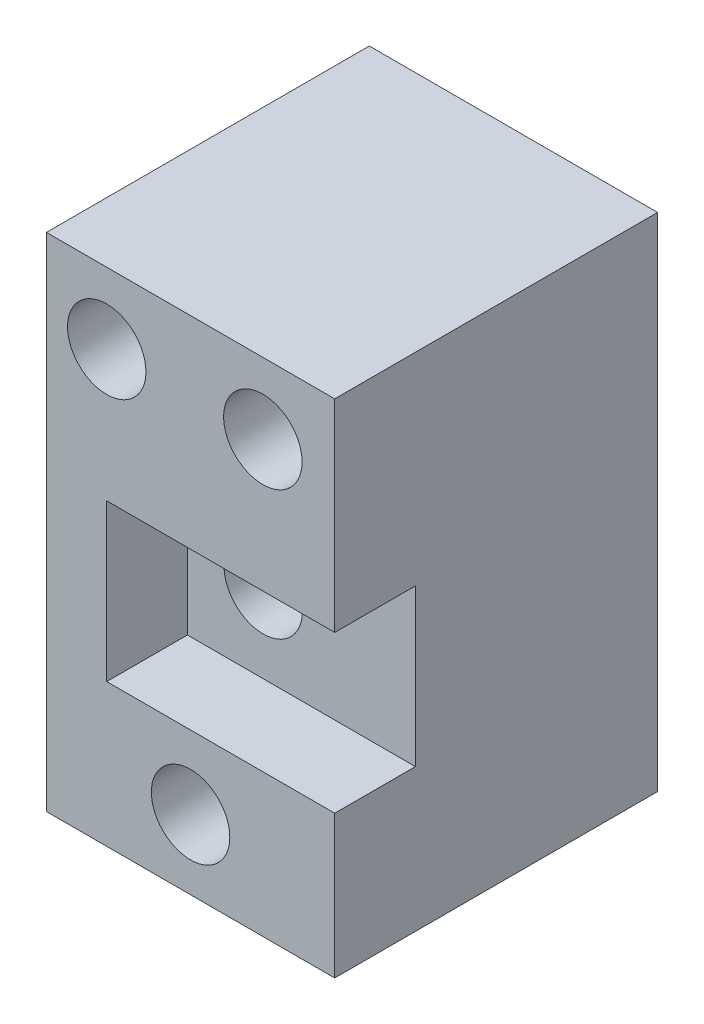
from build123d import *

# Parameters (mm, degrees)
ESQUISSE1_W             = 12.5
ESQUISSE1_H             = 21.75
BOSS_EXTRU_3_DEPTH      = 14
ESQUISSE9_W             = 10.579409941
ESQUISSE9_H             = 6.787962443
ENL_V_MAT_EXTRU_7_DEPTH = 3.5
D_GAGEMENT_M32_D        = 3.4
D_GAGEMENT_M33_D        = 3.4


with BuildPart() as part:
    # Esquisse1 → Boss.-Extru.3 (new body)
    with BuildSketch(Plane.XY):
        Rectangle(ESQUISSE1_W, ESQUISSE1_H)
    extrude(amount=BOSS_EXTRU_3_DEPTH)

    # Esquisse9 → Enlèv. mat.-Extru.7 (cut)
    with BuildSketch(Plane.XY.offset(14)):
        with Locations((1.654137431, -1.292305661)):
            Rectangle(ESQUISSE9_W, ESQUISSE9_H)
    extrude(amount=-ENL_V_MAT_EXTRU_7_DEPTH, mode=Mode.SUBTRACT)

    # Dégagement M32 (through all)
    with Locations(Plane.XY.offset(14)):
        with Locations((-0.35, -1.306160818)):
            Hole(D_GAGEMENT_M32_D / 2)

    # Dégagement M33 (through all)
    with Locations(Plane.XY.offset(14)):
        with Locations((-3.63556754, 7.794867284), (3.134168266, 7.794867284), (0, -7.865811289)):
            Hole(D_GAGEMENT_M33_D / 2)


solid = part.part
